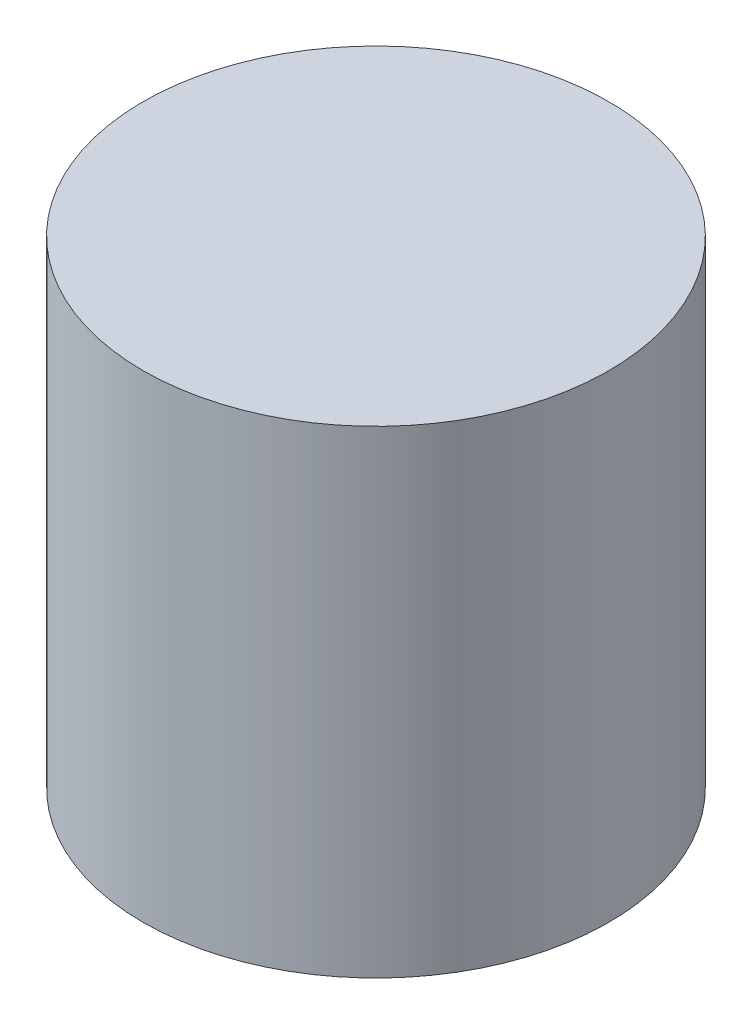
from build123d import *

# Parameters (mm, degrees)
SKETCH1_R           = 97.5
BOSS_EXTRUDE1_DEPTH = 200


with BuildPart() as part:
    # Sketch1 → Boss-Extrude1 (new body)
    with BuildSketch(Plane(origin=(0, 0, 0), x_dir=(1, 0, 0), z_dir=(0, 1, 0))):
        with Locations(Location((0, 0, 0), (0, 0, 270))):
            Circle(SKETCH1_R)
    extrude(amount=BOSS_EXTRUDE1_DEPTH)


solid = part.part
